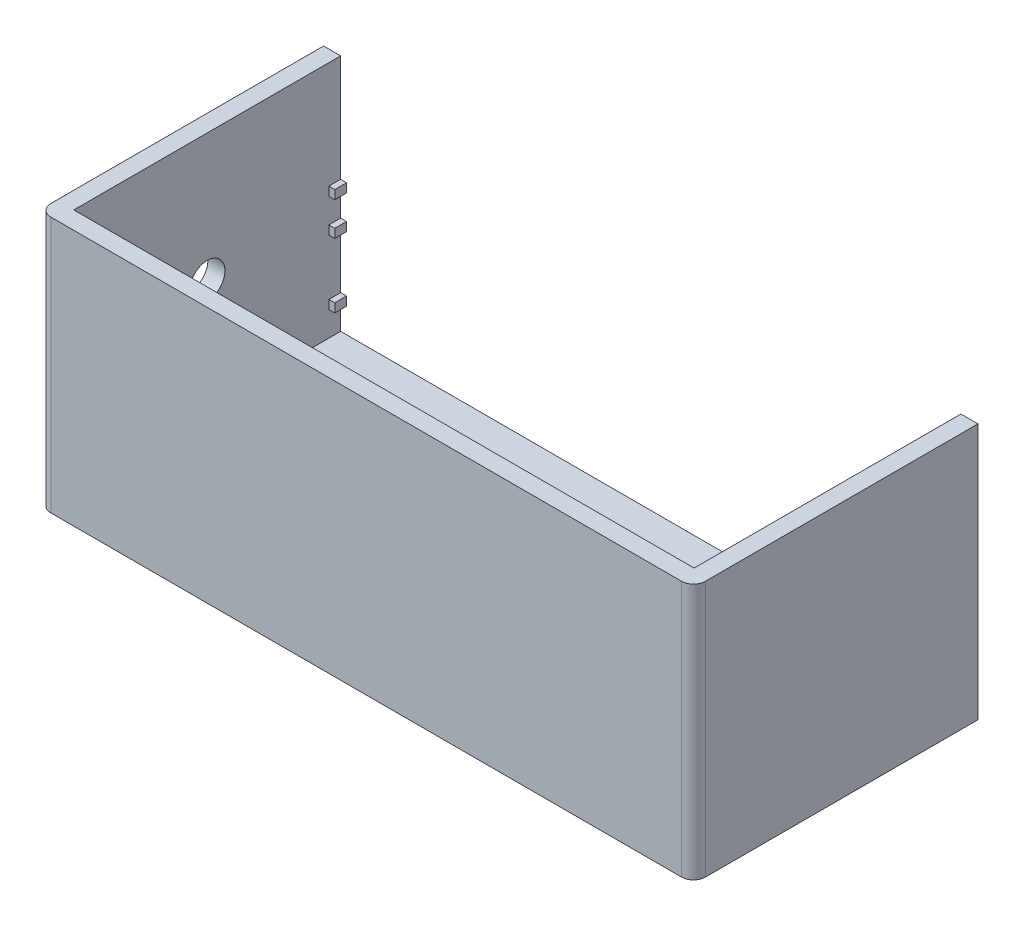
from build123d import *

# Parameters (mm, degrees)
SKETCH1_W           = 111.1
SKETCH1_H           = 51.3
BOSS_EXTRUDE1_DEPTH = 3
SKETCH2_W           = 111.1
SKETCH2_H           = 51.3
SKETCH2_W_2         = 105.3
SKETCH2_H_2         = 45.3
BOSS_EXTRUDE2_DEPTH = 40.5
SKETCH5_R           = 21
BOSS_EXTRUDE4_DEPTH = 15
SKETCH6_W           = 15.5
SKETCH6_H           = 37
CUT_EXTRUDE1_DEPTH  = 21
BOSS_EXTRUDE5_START = -1
SKETCH8_R           = 21
SKETCH8_W           = 12.3
SKETCH8_H           = 34.3
BOSS_EXTRUDE5_DEPTH = 1
BOSS_EXTRUDE6_START = -1
SKETCH9_R           = 21
SKETCH9_W           = 12.3
SKETCH9_H           = 34.3
BOSS_EXTRUDE6_DEPTH = 1
SKETCH10_W          = 126.244554882
SKETCH10_H          = 68.697179438
CUT_EXTRUDE3_DEPTH  = 53
SKETCH12_W          = 1
SKETCH12_H          = 1.5
BOSS_EXTRUDE8_DEPTH = 2
FILLET1_R           = 2
SKETCH13_R          = 3
CUT_EXTRUDE4_DEPTH  = 14


with BuildPart() as part:
    # Sketch1 → Boss-Extrude1 (new body)
    with BuildSketch(Plane(origin=(0, 0, 0), x_dir=(1, 0, 0), z_dir=(0, 1, 0))):
        Rectangle(SKETCH1_W, SKETCH1_H)
    extrude(amount=BOSS_EXTRUDE1_DEPTH)

    # Sketch2 → Boss-Extrude2 (add)
    with BuildSketch(Plane(origin=(0, 3, 0), x_dir=(1, 0, 0), z_dir=(0, 1, 0))):
        Rectangle(SKETCH2_W, SKETCH2_H)
        Rectangle(SKETCH2_W_2, SKETCH2_H_2, mode=Mode.SUBTRACT)
    extrude(amount=BOSS_EXTRUDE2_DEPTH)

    # Sketch5 → Boss-Extrude4 (add)
    with BuildSketch(Plane(origin=(0, 0, -25.65), x_dir=(-1, 0, 0), z_dir=(0, 0, -1))):
        with Locations((-27.775, 21.75)):
            Circle(SKETCH5_R)
        with Locations(Location((27.775, 21.75, 0), (0, 0, 180))):
            Circle(SKETCH5_R)
    extrude(amount=BOSS_EXTRUDE4_DEPTH)

    # Sketch6 → Cut-Extrude1 (cut)
    with BuildSketch(Plane(origin=(0, 0, -40.65), x_dir=(-1, 0, 0), z_dir=(0, 0, -1))):
        with Locations((-27.775, 21.75)):
            Rectangle(SKETCH6_W, SKETCH6_H)
        with Locations((27.775, 21.75)):
            Rectangle(SKETCH6_W, SKETCH6_H)
    extrude(amount=-CUT_EXTRUDE1_DEPTH, mode=Mode.SUBTRACT)

    # Sketch8 → Boss-Extrude5 (add)
    with BuildSketch(Plane(origin=(0, 0, -40.65), x_dir=(-1, 0, 0), z_dir=(0, 0, -1)).offset(BOSS_EXTRUDE5_START)):
        with Locations((-27.775, 21.75)):
            Circle(SKETCH8_R)
        with Locations((-27.775, 21.75)):
            Rectangle(SKETCH8_W, SKETCH8_H, mode=Mode.SUBTRACT)
    extrude(amount=BOSS_EXTRUDE5_DEPTH)

    # Sketch9 → Boss-Extrude6 (add)
    with BuildSketch(Plane(origin=(0, 0, -40.65), x_dir=(-1, 0, 0), z_dir=(0, 0, -1)).offset(BOSS_EXTRUDE6_START)):
        with Locations(Location((27.775, 21.75, 0), (0, 0, 180))):
            Circle(SKETCH9_R)
        with Locations((27.775, 21.75)):
            Rectangle(SKETCH9_W, SKETCH9_H, mode=Mode.SUBTRACT)
    extrude(amount=BOSS_EXTRUDE6_DEPTH)

    # Sketch10 → Cut-Extrude3 (cut)
    with BuildSketch(Plane.XY.offset(-22.65)):
        with Locations((0, 21.75)):
            Rectangle(SKETCH10_W, SKETCH10_H)
    extrude(amount=-CUT_EXTRUDE3_DEPTH, mode=Mode.SUBTRACT)

    # Sketch12 → Boss-Extrude8 (add)
    with BuildSketch(Plane(origin=(0, 0, -22.65), x_dir=(-1, 0, 0), z_dir=(0, 0, -1))):
        with Locations((52.15, 18.9)):
            Rectangle(SKETCH12_W, SKETCH12_H)
        with Locations((52.15, 7.95)):
            Rectangle(SKETCH12_W, SKETCH12_H)
        with Locations((-52.15, 18.9)):
            Rectangle(SKETCH12_W, SKETCH12_H)
        with Locations((-52.15, 24.6)):
            Rectangle(SKETCH12_W, SKETCH12_H)
        with Locations((52.15, 24.6)):
            Rectangle(SKETCH12_W, SKETCH12_H)
        with Locations((-52.15, 7.95)):
            Rectangle(SKETCH12_W, SKETCH12_H)
    extrude(amount=-BOSS_EXTRUDE8_DEPTH)

    # Fillet1
    fillet1_edges = [part.edges().sort_by_distance(p)[0] for p in [
        (55.55, 21.75, 25.65),
        (-55.55, 21.75, 25.65),
    ]]
    fillet(fillet1_edges, radius=FILLET1_R)

    # Sketch13 → Cut-Extrude4 (cut)
    with BuildSketch(Plane(origin=(-52.65, 0, 0), x_dir=(0, 0, -1), z_dir=(1, 0, 0))):
        with Locations((0, 21.75)):
            Circle(SKETCH13_R)
    extrude(amount=-CUT_EXTRUDE4_DEPTH, mode=Mode.SUBTRACT)


solid = part.part
